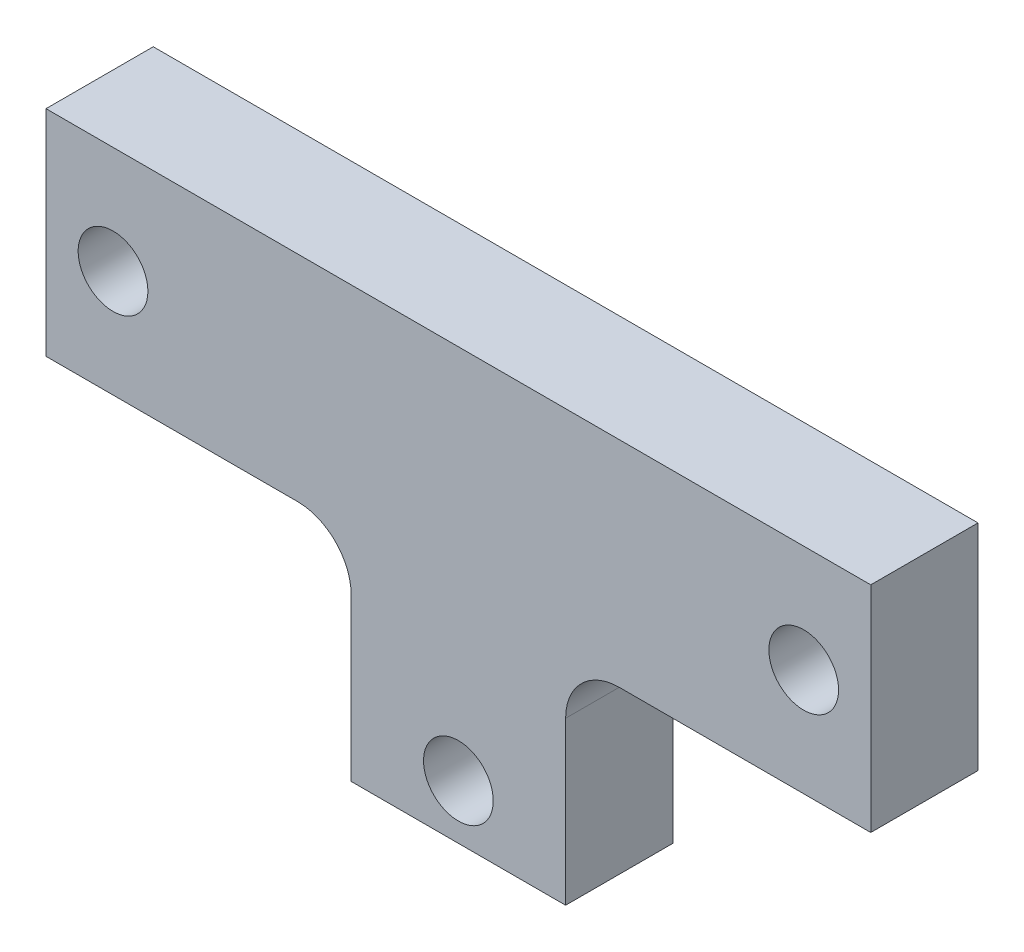
from build123d import *

# Parameters (mm, degrees)
BOSS_EXTRUDE1_DEPTH = 10
SKETCH2_R           = 2
CUT_EXTRUDE1_DEPTH  = 52.590817981
SKETCH3_R           = 3.25
CUT_EXTRUDE2_DEPTH  = 6
FILLET1_R           = 5
SKETCH4_W           = 10
SKETCH4_H           = 20
BOSS_EXTRUDE2_DEPTH = 2
SKETCH5_W           = 10
SKETCH5_H           = 20
BOSS_EXTRUDE3_DEPTH = 2


with BuildPart() as part:
    # Sketch1 → Boss-Extrude1 (new body)
    with BuildSketch(Plane.XY):
        Polygon((0, 0), (0, -20.1), (20, -20.1), (20, 0), (46.45, 0), (46.45, 20), (-26.45, 20), (-26.45, 0), align=None)
    extrude(amount=BOSS_EXTRUDE1_DEPTH)

    # Sketch2 → Cut-Extrude1 (cut, through all)
    with BuildSketch(Plane.XY.offset(10)):
        with Locations((-22.2, 10)):
            Circle(SKETCH2_R)
        with Locations((10, -15.05)):
            Circle(SKETCH2_R)
        with Locations(Location((42.2, 10, 0), (0, 0, 180))):
            Circle(SKETCH2_R)
    extrude(amount=-CUT_EXTRUDE1_DEPTH, mode=Mode.SUBTRACT)

    # Sketch3 → Cut-Extrude2 (cut)
    with BuildSketch(Plane.XY.offset(10)):
        with Locations((-22.2, 10)):
            Circle(SKETCH3_R)
        with Locations((42.2, 10)):
            Circle(SKETCH3_R)
        with Locations((10, -15.05)):
            Circle(SKETCH3_R)
    extrude(amount=-CUT_EXTRUDE2_DEPTH, mode=Mode.SUBTRACT)

    # Fillet1
    fillet1_edges = [part.edges().sort_by_distance(p)[0] for p in [
        (20, 0, 5),
        (0, 0, 5),
    ]]
    fillet(fillet1_edges, radius=FILLET1_R)

    # Sketch4 → Boss-Extrude2 (add)
    with BuildSketch(Plane(origin=(46.45, 0, 0), x_dir=(0, 0, -1), z_dir=(1, 0, 0))):
        with Locations((-5, 10)):
            Rectangle(SKETCH4_W, SKETCH4_H)
    extrude(amount=BOSS_EXTRUDE2_DEPTH)

    # Sketch5 → Boss-Extrude3 (add)
    with BuildSketch(Plane.ZY.offset(26.45)):
        with Locations((5, 10)):
            Rectangle(SKETCH5_W, SKETCH5_H)
    extrude(amount=BOSS_EXTRUDE3_DEPTH)


solid = part.part
